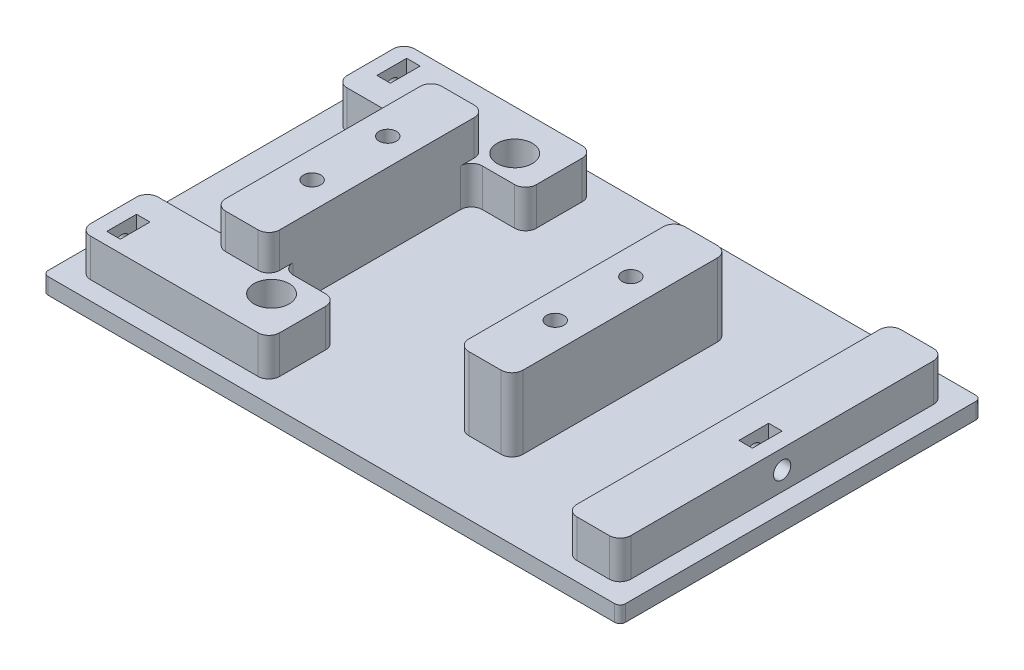
from build123d import *

# Parameters (mm, degrees)
SKETCH1_W                        = 70
SKETCH1_H                        = 40
BOSS_EXTRUDE1_DEPTH              = 6.5
SKETCH2_W                        = 100
SKETCH2_H                        = 60
BOSS_EXTRUDE2_DEPTH              = 10
M3_CLEARANCE_HOLE1_D             = 3.2
SKETCH40_R                       = 3
CUT_EXTRUDE10_DEPTH              = 13.5
SKETCH7_W                        = 106.84
SKETCH7_H                        = 66.84
SKETCH7_W_2                      = 100
SKETCH7_H_2                      = 60
BOSS_EXTRUDE3_DEPTH              = 3
CUT_EXTRUDE2_DEPTH               = 1.25
M3_CLEARANCE_HOLE3_D             = 3.2
M3_CLEARANCE_HOLE3_DEPTH         = 12
M3_CLEARANCE_HOLE3_TIP           = 0.96137699
SKETCH23_W                       = 6.48
SKETCH23_H                       = 3
BOSS_EXTRUDE5_DEPTH              = 10
SKETCH26_W                       = 3.2639
SKETCH26_H                       = 13
F_1_4_CLEARANCE_HOLE2_AT_2_COUNT = 2
F_1_4_CLEARANCE_HOLE2_AT_2_PITCH = 45
SKETCH41_W                       = 35
SKETCH41_H                       = 40
SKETCH41_W_2                     = 10
SKETCH41_W_3                     = 5
CUT_EXTRUDE11_DEPTH              = 6.5
SKETCH42_W                       = 15
SKETCH42_H                       = 35
SKETCH42_W_2                     = 10
SKETCH42_H_2                     = 40
CUT_EXTRUDE12_DEPTH              = 7
CUT_EXTRUDE13_DEPTH              = 1.25
M3_CLEARANCE_HOLE5_D             = 3.2
M3_CLEARANCE_HOLE5_DEPTH         = 10
M3_CLEARANCE_HOLE5_TIP           = 0.96137699
FILLET1_R                        = 2
FILLET2_R                        = 1


with BuildPart() as part:
    # Sketch1 → Boss-Extrude1 (new body)
    with BuildSketch(Plane(origin=(0, 0, 0), x_dir=(1, 0, 0), z_dir=(0, 1, 0))):
        Rectangle(SKETCH1_W, SKETCH1_H)
    extrude(amount=-BOSS_EXTRUDE1_DEPTH)

    # Sketch2 → Boss-Extrude2 (add)
    with BuildSketch(Plane.XZ.offset(6.5)):
        with Locations((10, 0)):
            Rectangle(SKETCH2_W, SKETCH2_H)
    extrude(amount=BOSS_EXTRUDE2_DEPTH)

    # M3 Clearance Hole1 (through all)
    with Locations(Plane(origin=(0, 0, 0), x_dir=(1, 0, 0), z_dir=(0, 1, 0))):
        with Locations((-20, 7), (25, 7), (-20, -7), (25, -7)):
            Hole(M3_CLEARANCE_HOLE1_D / 2)

    # Sketch40 → Cut-Extrude10 (cut)
    with BuildSketch(Plane.XZ.offset(16.5)):
        with Locations(Location((-20, 7, 0), (0, 0, 270))):
            Circle(SKETCH40_R)
        with Locations(Location((-20, -7, 0), (0, 0, 270))):
            Circle(SKETCH40_R)
        with Locations(Location((25, 7, 0), (0, 0, 270))):
            Circle(SKETCH40_R)
        with Locations(Location((25, -7, 0), (0, 0, 270))):
            Circle(SKETCH40_R)
    extrude(amount=-CUT_EXTRUDE10_DEPTH, mode=Mode.SUBTRACT)

    # Sketch7 → Boss-Extrude3 (add)
    with BuildSketch(Plane.XZ.offset(16.5)):
        with Locations((10, 0)):
            Rectangle(SKETCH7_W, SKETCH7_H)
        with Locations((10, 0)):
            Rectangle(SKETCH7_W_2, SKETCH7_H_2, mode=Mode.SUBTRACT)
    extrude(amount=-BOSS_EXTRUDE3_DEPTH)

    # Sketch14 → Cut-Extrude2 (cut, symmetric)
    with BuildSketch(Plane.ZY.offset(36)):
        Polygon((-27.75, -8.41228676), (-27.75, -6.5), (-22.25, -6.5), (-22.25, -8.41228676), (-22.25, -11.58771324), (-25, -13.175426481), (-27.75, -11.58771324), align=None)
        Polygon((22.25, -8.41228676), (22.25, -11.58771324), (25, -13.175426481), (27.75, -11.58771324), (27.75, -8.41228676), (27.75, -6.5), (22.25, -6.5), align=None)
    extrude(amount=CUT_EXTRUDE2_DEPTH, both=True, mode=Mode.SUBTRACT)

    # M3 Clearance Hole3
    with Locations(Plane.ZY.offset(40)):
        with Locations((-25, -10), (25, -10)):
            Hole(M3_CLEARANCE_HOLE3_D / 2, depth=M3_CLEARANCE_HOLE3_DEPTH)
            with Locations((0, 0, -(M3_CLEARANCE_HOLE3_DEPTH + M3_CLEARANCE_HOLE3_TIP / 2))):  # 118° drill point
                Cone(0, M3_CLEARANCE_HOLE3_D / 2, M3_CLEARANCE_HOLE3_TIP, mode=Mode.SUBTRACT)

    # Sketch23 → Boss-Extrude5 (add, symmetric)
    with BuildSketch(Plane.XY):
        with Locations((-12, -18)):
            Rectangle(SKETCH23_W, SKETCH23_H)
    extrude(amount=BOSS_EXTRUDE5_DEPTH, both=True)

    # Sketch26 → 1/4 Clearance Hole2 (revolve, cut)
    with BuildSketch(Plane(origin=(-12, -6.5, -22.5), x_dir=(0, 0, 1), z_dir=(1, 0, 0))):
        with Locations((1.63195, 6.5)):
            Rectangle(SKETCH26_W, SKETCH26_H)
    f_1_4_clearance_hole2 = revolve(axis=Axis((-12, -0.15, -22.5), (0, -1, 0)), mode=Mode.SUBTRACT)

    # 1/4 Clearance Hole2 at 2: 1/4 Clearance Hole2 ×2
    with Locations(*[(0, 0, i * F_1_4_CLEARANCE_HOLE2_AT_2_PITCH) for i in range(1, F_1_4_CLEARANCE_HOLE2_AT_2_COUNT)]):
        add(f_1_4_clearance_hole2, mode=Mode.SUBTRACT)

    # Sketch41 → Cut-Extrude11 (cut)
    with BuildSketch(Plane(origin=(0, 0, 0), x_dir=(1, 0, 0), z_dir=(0, 1, 0))):
        with Locations((2.5, 0)):
            Rectangle(SKETCH41_W, SKETCH41_H)
        with Locations((-30, 0)):
            Rectangle(SKETCH41_W_2, SKETCH41_H)
        with Locations((32.5, 0)):
            Rectangle(SKETCH41_W_3, SKETCH41_H)
    extrude(amount=-CUT_EXTRUDE11_DEPTH, mode=Mode.SUBTRACT)

    # Sketch42 → Cut-Extrude12 (cut)
    # profile 1 of 2: a face of its own
    with BuildSketch(Plane(origin=(0, -6.5, 0), x_dir=(1, 0, 0), z_dir=(0, 1, 0))):
        with Locations((-32.5, 0)):
            Rectangle(SKETCH42_W, SKETCH42_H)
    # profile 2 of 2: a face of its own
    with BuildSketch(Plane(origin=(0, -6.5, 0), x_dir=(1, 0, 0), z_dir=(0, 1, 0))):
        Polygon((20, -30), (30, -30), (50, -30), (50, 30), (30, 30), (20, 30), (-5, 30), (-5, 17.5), (-15, 17.5), (-15, -17.5), (-5, -17.5), (-5, -30), align=None)
        with Locations((25, 0)):
            Rectangle(SKETCH42_W_2, SKETCH42_H_2, mode=Mode.SUBTRACT)
    extrude(amount=-CUT_EXTRUDE12_DEPTH, mode=Mode.SUBTRACT)

    # Sketch44 → Cut-Extrude13 (cut, symmetric)
    with BuildSketch(Plane(origin=(56, 0, 0), x_dir=(0, 0, -1), z_dir=(1, 0, 0))):
        Polygon((-2.75, -8.41228676), (-2.75, -11.58771324), (0, -13.175426481), (2.75, -11.58771324), (2.75, -8.41228676), (2.75, -6.5), (-2.75, -6.5), align=None)
    extrude(amount=CUT_EXTRUDE13_DEPTH, both=True, mode=Mode.SUBTRACT)

    # M3 Clearance Hole5
    with Locations(Plane(origin=(60, 0, 0), x_dir=(0, 0, -1), z_dir=(1, 0, 0))):
        with Locations((0, -10)):
            Hole(M3_CLEARANCE_HOLE5_D / 2, depth=M3_CLEARANCE_HOLE5_DEPTH)
            with Locations((0, 0, -(M3_CLEARANCE_HOLE5_DEPTH + M3_CLEARANCE_HOLE5_TIP / 2))):  # 118° drill point
                Cone(0, M3_CLEARANCE_HOLE5_D / 2, M3_CLEARANCE_HOLE5_TIP, mode=Mode.SUBTRACT)

    # Fillet1
    fillet1_edges = [part.edges().sort_by_distance(p)[0] for p in [
        (30, -6.75, -20),
        (30, -6.75, 20),
        (-25, -3.25, 20),
        (-25, -3.25, -20),
        (20, -6.75, 20),
        (20, -6.75, -20),
        (-15, -3.25, -20),
        (-15, -3.25, 20),
        (-25, -10, 17.5),
        (-25, -10, -17.5),
        (-40, -10, -17.5),
        (-40, -10, 17.5),
        (-15, -10, -17.5),
        (-5, -10, -17.5),
        (-5, -10, -30),
        (50, -10, -30),
        (50, -10, 30),
        (-5, -10, 30),
        (-5, -10, 17.5),
        (-15, -10, 17.5),
        (-40, -10, 30),
        (60, -10, 30),
        (60, -10, -30),
        (-40, -10, -30),
    ]]
    fillet(fillet1_edges, radius=FILLET1_R)

    # Fillet2
    fillet2_edges = [part.edges().sort_by_distance(p)[0] for p in [
        (-43.42, -15, 33.42),
        (63.42, -15, 33.42),
        (63.42, -15, -33.42),
        (-43.42, -15, -33.42),
    ]]
    fillet(fillet2_edges, radius=FILLET2_R)


solid = part.part
